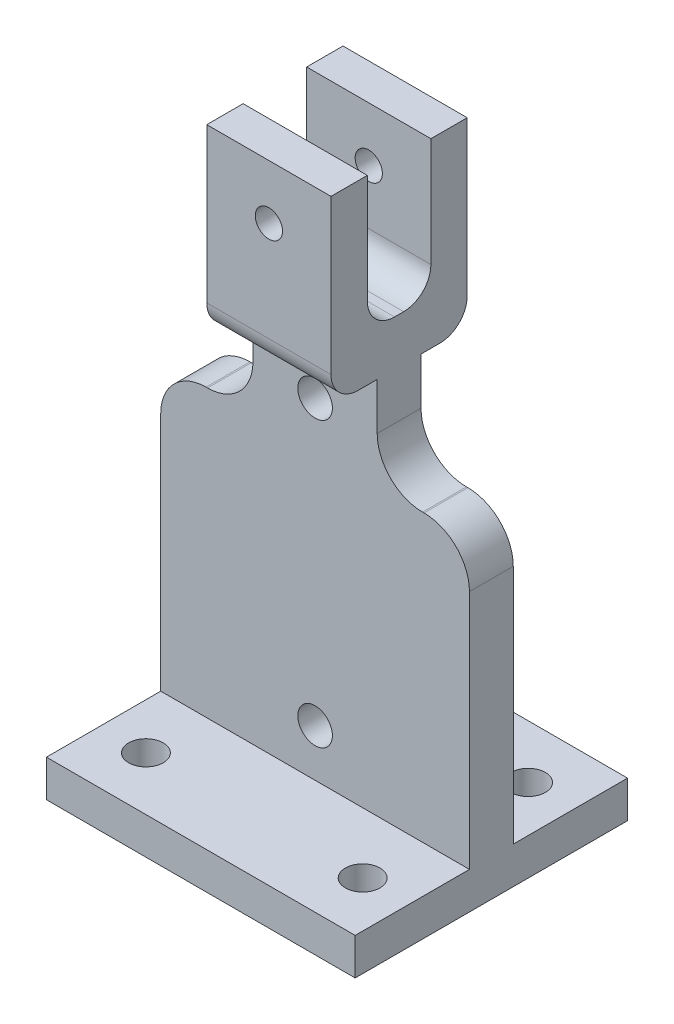
from build123d import *

# Parameters (mm, degrees)
SKETCH1_R           = 1.905
BOSS_EXTRUDE1_DEPTH = 2.413
SKETCH3_W           = 34
SKETCH3_H           = 30
SKETCH3_R           = 1.905
BOSS_EXTRUDE2_DEPTH = 4.064
FILLET1_R           = 5
SKETCH5_W           = 13.68
SKETCH5_H           = 4.826
SKETCH5_H_2         = 1.087
BOSS_EXTRUDE4_DEPTH = 5
SKETCH5_3_W         = 13.68
SKETCH5_3_H         = 4
BOSS_EXTRUDE5_DEPTH = 20
CUT_EXTRUDE1_REACH  = 69.799
SKETCH6_R           = 1.5
FILLET2_R           = 3


with BuildPart() as part:
    # Sketch1 → Boss-Extrude1 (new, symmetric)
    # profile 1 of 2: a face of its own
    with BuildSketch(Plane.XY):
        Polygon((-17, 31.496), (-17, 0), (17, 0), (17, 31.496), (6.84, 31.496), (6.84, 41.656), (-6.84, 41.656), (-6.84, 31.496), align=None)
        with Locations((0, 5.207)):
            Circle(SKETCH1_R, mode=Mode.SUBTRACT)
        with Locations((0, 36.449)):
            Circle(SKETCH1_R, mode=Mode.SUBTRACT)
    # profile 2 of 2: a face of its own
    with BuildSketch(Plane.XY):
        Polygon((-17, 31.496), (-17, 0), (17, 0), (17, 31.496), (6.84, 31.496), (6.84, 41.656), (-6.84, 41.656), (-6.84, 31.496), align=None)
        with Locations((0, 5.207)):
            Circle(SKETCH1_R, mode=Mode.SUBTRACT)
        with Locations((0, 36.449)):
            Circle(SKETCH1_R, mode=Mode.SUBTRACT)
    extrude(amount=BOSS_EXTRUDE1_DEPTH, both=True)

    # Sketch3 → Boss-Extrude2 (add)
    with BuildSketch(Plane(origin=(0, 0, 0), x_dir=(1, 0, 0), z_dir=(0, 1, 0))):
        Rectangle(SKETCH3_W, SKETCH3_H)
        with Locations(Location((-11.935, -9.11, 0), (0, 0, 270))):
            Circle(SKETCH3_R, mode=Mode.SUBTRACT)
        with Locations(Location((11.935, -9.11, 0), (0, 0, 270))):
            Circle(SKETCH3_R, mode=Mode.SUBTRACT)
        with Locations(Location((11.935, 9.11, 0), (0, 0, 270))):
            Circle(SKETCH3_R, mode=Mode.SUBTRACT)
        with Locations(Location((-11.935, 9.11, 0), (0, 0, 270))):
            Circle(SKETCH3_R, mode=Mode.SUBTRACT)
    extrude(amount=-BOSS_EXTRUDE2_DEPTH)

    # Fillet1
    fillet1_edges = [part.edges().sort_by_distance(p)[0] for p in [
        (6.84, 31.496, 0),
        (17, 31.496, 0),
        (-17, 31.496, 0),
        (-6.84, 31.496, 0),
    ]]
    fillet(fillet1_edges, radius=FILLET1_R)

    # Sketch5 → Boss-Extrude4 (add)
    with BuildSketch(Plane(origin=(0, 41.656, 0), x_dir=(1, 0, 0), z_dir=(0, 1, 0))):
        Rectangle(SKETCH5_W, SKETCH5_H)
        with Locations((0, -2.9565)):
            Rectangle(SKETCH5_W, SKETCH5_H_2)
        with Locations((0, 2.9565)):
            Rectangle(SKETCH5_W, SKETCH5_H_2)
    extrude(amount=BOSS_EXTRUDE4_DEPTH)

    # Sketch5<3> → Boss-Extrude5 (add)
    with BuildSketch(Plane(origin=(0, 41.656, 0), x_dir=(1, 0, 0), z_dir=(0, 1, 0))):
        with Locations((0, -5.5)):
            Rectangle(SKETCH5_3_W, SKETCH5_3_H)
        with Locations((0, 5.5)):
            Rectangle(SKETCH5_3_W, SKETCH5_3_H)
    extrude(amount=BOSS_EXTRUDE5_DEPTH)

    # Cut-Extrude1: up to this face of the body (flat: up to its plane)
    cut_extrude1_end = Plane(part.part.faces().sort_by_distance((0, 51.656, 7.5))[0])
    # Sketch6 → Cut-Extrude1 (cut, up to the picked face)
    with BuildSketch(Plane(origin=(0, 0, -7.5), x_dir=(-1, 0, 0), z_dir=(0, 0, -1)), mode=Mode.PRIVATE) as cut_extrude1_sk1:
        with Locations((0, 55.656)):
            Circle(SKETCH6_R)
    cut_extrude1_tool1 = split(extrude(cut_extrude1_sk1.sketch, amount=-CUT_EXTRUDE1_REACH, mode=Mode.PRIVATE), bisect_by=cut_extrude1_end, keep=Keep.BOTH, mode=Mode.PRIVATE)
    add(cut_extrude1_tool1.solids().sort_by(Axis((0, 55.656, -7.5), (0, 0, 1)))[0], mode=Mode.SUBTRACT)

    # Fillet2
    fillet2_edges = [part.edges().sort_by_distance(p)[0] for p in [
        (0, 41.656, -7.5),
        (0, 46.656, -3.5),
        (0, 46.656, 3.5),
        (0, 41.656, 7.5),
    ]]
    fillet(fillet2_edges, radius=FILLET2_R)


solid = part.part
